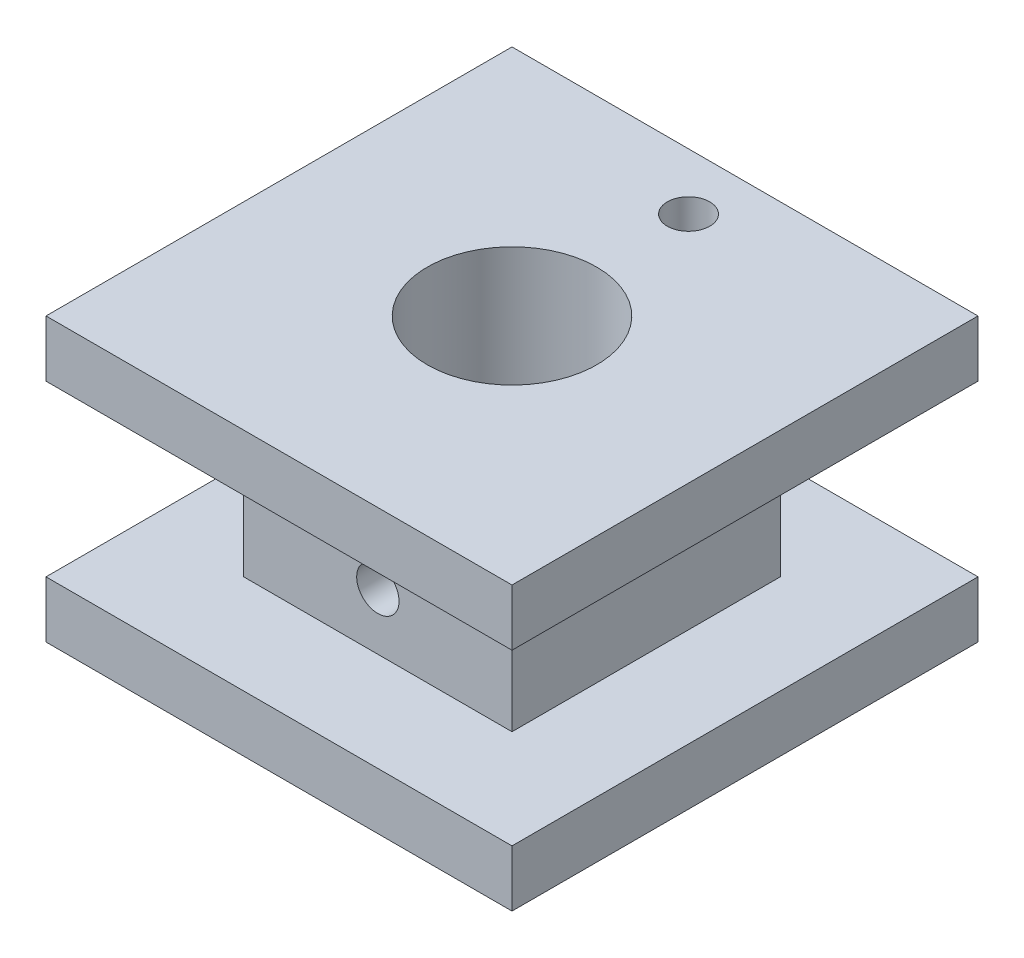
from build123d import *

# Parameters (mm, degrees)
SKETCH3_W                                  = 33
SKETCH3_H                                  = 33
BOSS_EXTRUDE1_DEPTH                        = 20
SKETCH4_W                                  = 33
SKETCH4_H                                  = 12
CUT_EXTRUDE1_DEPTH                         = 7
MIRROR7_AT_THE_SECOND_PLANE_COPY_1_SKETC_W = 33
MIRROR7_AT_THE_SECOND_PLANE_COPY_1_SKETC_H = 12
MIRROR7_AT_THE_SECOND_PLANE_COPY_1_DEPTH   = 7
SKETCH6_W                                  = 19
SKETCH6_H                                  = 12
CUT_EXTRUDE2_DEPTH                         = 7
MIRROR8_AT_THE_SECOND_PLANE_COPY_1_SKETC_W = 19
MIRROR8_AT_THE_SECOND_PLANE_COPY_1_SKETC_H = 12
MIRROR8_AT_THE_SECOND_PLANE_COPY_1_DEPTH   = 7
SKETCH7_R                                  = 6
CUT_EXTRUDE3_DEPTH                         = 31.732718721
SKETCH9_R                                  = 1.5
CUT_EXTRUDE5_DEPTH                         = 7.5
SKETCH10_R                                 = 1.5
CUT_EXTRUDE9_DEPTH                         = 4


with BuildPart() as part:
    # Sketch3 → Boss-Extrude1 (new body)
    with BuildSketch(Plane(origin=(0, 0, 0), x_dir=(1, 0, 0), z_dir=(0, 1, 0))):
        Rectangle(SKETCH3_W, SKETCH3_H)
    extrude(amount=BOSS_EXTRUDE1_DEPTH)

    # Sketch4 → Cut-Extrude1 (cut)
    with BuildSketch(Plane.XY.offset(16.5)):
        with Locations((0, 10)):
            Rectangle(SKETCH4_W, SKETCH4_H)
    cut_extrude1 = extrude(amount=-CUT_EXTRUDE1_DEPTH, mode=Mode.SUBTRACT)

    # Mirror7: Cut-Extrude1 across plane
    add(cut_extrude1.mirror(Plane(origin=(0, 0, 0), x_dir=(0, 0, 1), z_dir=(1, 0, 0))), mode=Mode.SUBTRACT)

    # Mirror7 at the second plane: Cut-Extrude1 across plane
    add(cut_extrude1.mirror(Plane.XY), mode=Mode.SUBTRACT)

    # Mirror7 at the second plane copy 1 sketc → Mirror7 at the second plane copy 1 (cut)
    with BuildSketch(Plane(origin=(0, 0, -16.5), x_dir=(-1, 0, 0), z_dir=(0, 0, -1))):
        with Locations((0, 10)):
            Rectangle(MIRROR7_AT_THE_SECOND_PLANE_COPY_1_SKETC_W, MIRROR7_AT_THE_SECOND_PLANE_COPY_1_SKETC_H)
    extrude(amount=-MIRROR7_AT_THE_SECOND_PLANE_COPY_1_DEPTH, mode=Mode.SUBTRACT)

    # Sketch6 → Cut-Extrude2 (cut)
    with BuildSketch(Plane(origin=(16.5, 0, 0), x_dir=(0, 0, -1), z_dir=(1, 0, 0))):
        with Locations((0, 10)):
            Rectangle(SKETCH6_W, SKETCH6_H)
    cut_extrude2 = extrude(amount=-CUT_EXTRUDE2_DEPTH, mode=Mode.SUBTRACT)

    # Mirror8: Cut-Extrude2 across plane
    add(cut_extrude2.mirror(Plane.XY), mode=Mode.SUBTRACT)

    # Mirror8 at the second plane: Cut-Extrude2 across plane
    add(cut_extrude2.mirror(Plane(origin=(0, 0, 0), x_dir=(0, 0, 1), z_dir=(1, 0, 0))), mode=Mode.SUBTRACT)

    # Mirror8 at the second plane copy 1 sketc → Mirror8 at the second plane copy 1 (cut)
    with BuildSketch(Plane.ZY.offset(16.5)):
        with Locations((0, 10)):
            Rectangle(MIRROR8_AT_THE_SECOND_PLANE_COPY_1_SKETC_W, MIRROR8_AT_THE_SECOND_PLANE_COPY_1_SKETC_H)
    extrude(amount=-MIRROR8_AT_THE_SECOND_PLANE_COPY_1_DEPTH, mode=Mode.SUBTRACT)

    # Sketch7 → Cut-Extrude3 (cut, through all)
    with BuildSketch(Plane(origin=(0, 20, 0), x_dir=(1, 0, 0), z_dir=(0, 1, 0))):
        with Locations(Location((0, 0, 0), (0, 0, 270))):
            Circle(SKETCH7_R)
    extrude(amount=-CUT_EXTRUDE3_DEPTH, mode=Mode.SUBTRACT)

    # Sketch9 → Cut-Extrude5 (cut, symmetric)
    with BuildSketch(Plane(origin=(0, 20, 0), x_dir=(1, 0, 0), z_dir=(0, 1, 0))):
        with Locations(Location((0, 12.5, 0), (0, 0, 180))):
            Circle(SKETCH9_R)
    extrude(amount=CUT_EXTRUDE5_DEPTH, both=True, mode=Mode.SUBTRACT)

    # Sketch10 → Cut-Extrude9 (cut, symmetric)
    with BuildSketch(Plane.XY.offset(9.5)):
        with Locations(Location((0, 8, 0), (0, 0, 90))):
            Circle(SKETCH10_R)
    extrude(amount=CUT_EXTRUDE9_DEPTH, both=True, mode=Mode.SUBTRACT)


solid = part.part
